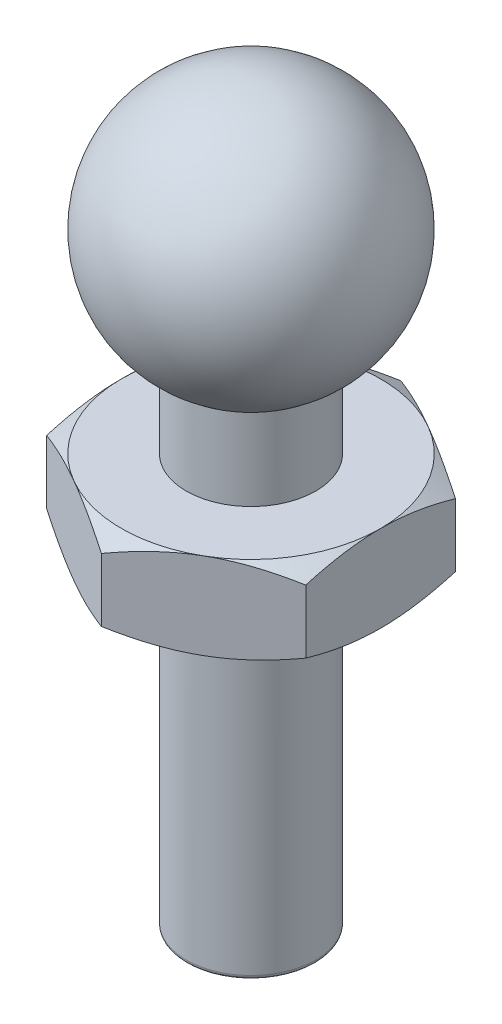
from build123d import *

# Parameters (mm, degrees)
FILLET1_R           = 0.1
BOSS_EXTRUDE1_START = 2
SKETCH3_R           = 1.5
BOSS_EXTRUDE1_DEPTH = 2
SKETCH4_OUTSIDE_W   = 18.79
SKETCH4_OUTSIDE_H   = 19.718
SKETCH4_OUTSIDE_R   = 3
CUT_EXTRUDE3_DEPTH  = 2
CUT_EXTRUDE3_DRAFT  = -60
SKETCH5_OUTSIDE_W   = 18.79
SKETCH5_OUTSIDE_H   = 19.718
SKETCH5_OUTSIDE_R   = 3
CUT_EXTRUDE4_DEPTH  = 2
CUT_EXTRUDE4_DRAFT  = -60


with BuildPart() as part:
    # Sketch1 → Revolve1 (revolve)
    with BuildSketch(Plane.XY):
        with BuildLine():
            Line((0, 0), (1.5, 0))
            Line((1.5, 0), (1.5, 11.401923789))
            ThreePointArc((1.5, 11.401923789), (2.897777479, 14.776457135), (0, 17))
            Line((0, 17), (0, 8.5))
            Line((0, 8.5), (0, 0))
        make_face()
    revolve(axis=Axis((0, 8.5, 0), (0, 1, 0)))

    # Fillet1
    fillet1_edges = [part.edges().sort_by_distance(p)[0] for p in [
        (-1.5, 0, 0),
    ]]
    fillet(fillet1_edges, radius=FILLET1_R)

    # Sketch3 → Boss-Extrude1 (add)
    with BuildSketch(Plane(origin=(0, 7.5, 0), x_dir=(1, 0, 0), z_dir=(0, 1, 0)).offset(BOSS_EXTRUDE1_START)):
        Polygon((0, 3.464101615), (-3, 1.732050808), (-3, -1.732050808), (0, -3.464101615), (3, -1.732050808), (3, 1.732050808), align=None)
        Circle(SKETCH3_R, mode=Mode.SUBTRACT)
    extrude(amount=-BOSS_EXTRUDE1_DEPTH)


with BuildPart() as cut_extrude3_tool:
    # Sketch4 outside → Cut-Extrude3 (with draft: the straight prism first)
    with BuildSketch(Plane.XZ.offset(-7.5)):
        Rectangle(SKETCH4_OUTSIDE_W, SKETCH4_OUTSIDE_H)
        Circle(SKETCH4_OUTSIDE_R, mode=Mode.SUBTRACT)
    extrude(amount=-CUT_EXTRUDE3_DEPTH)
    # Cut-Extrude3: the draft: its side faces are tilted about the plane it starts from
    cut_extrude3_sides = [cut_extrude3_tool.faces().sort_by_distance(p)[0] for p in [
        (0, 8.5, -9.859),
        (9.395, 8.5, 0),
        (0, 8.5, 9.859),
        (-9.395, 8.5, 0),
        (-3, 8.5, 0),
    ]]
    draft(cut_extrude3_sides, Plane.XZ.offset(-7.5), CUT_EXTRUDE3_DRAFT)


with BuildPart() as part_1:
    add(part.part)

    # Cut-Extrude3: cut by cut_extrude3_tool
    add(cut_extrude3_tool.part, mode=Mode.SUBTRACT)


with BuildPart() as cut_extrude4_tool:
    # Sketch5 outside → Cut-Extrude4 (with draft: the straight prism first)
    with BuildSketch(Plane(origin=(0, 9.5, 0), x_dir=(1, 0, 0), z_dir=(0, 1, 0))):
        Rectangle(SKETCH5_OUTSIDE_W, SKETCH5_OUTSIDE_H)
        Circle(SKETCH5_OUTSIDE_R, mode=Mode.SUBTRACT)
    extrude(amount=-CUT_EXTRUDE4_DEPTH)
    # Cut-Extrude4: the draft: its side faces are tilted about the plane it starts from
    cut_extrude4_sides = [cut_extrude4_tool.faces().sort_by_distance(p)[0] for p in [
        (0, 8.5, 9.859),
        (9.395, 8.5, 0),
        (0, 8.5, -9.859),
        (-9.395, 8.5, 0),
        (-3, 8.5, 0),
    ]]
    draft(cut_extrude4_sides, Plane(origin=(0, 9.5, 0), x_dir=(1, 0, 0), z_dir=(0, 1, 0)), CUT_EXTRUDE4_DRAFT)


with BuildPart() as part_2:
    add(part_1.part)

    # Cut-Extrude4: cut by cut_extrude4_tool
    add(cut_extrude4_tool.part, mode=Mode.SUBTRACT)


solid = part_2.part
